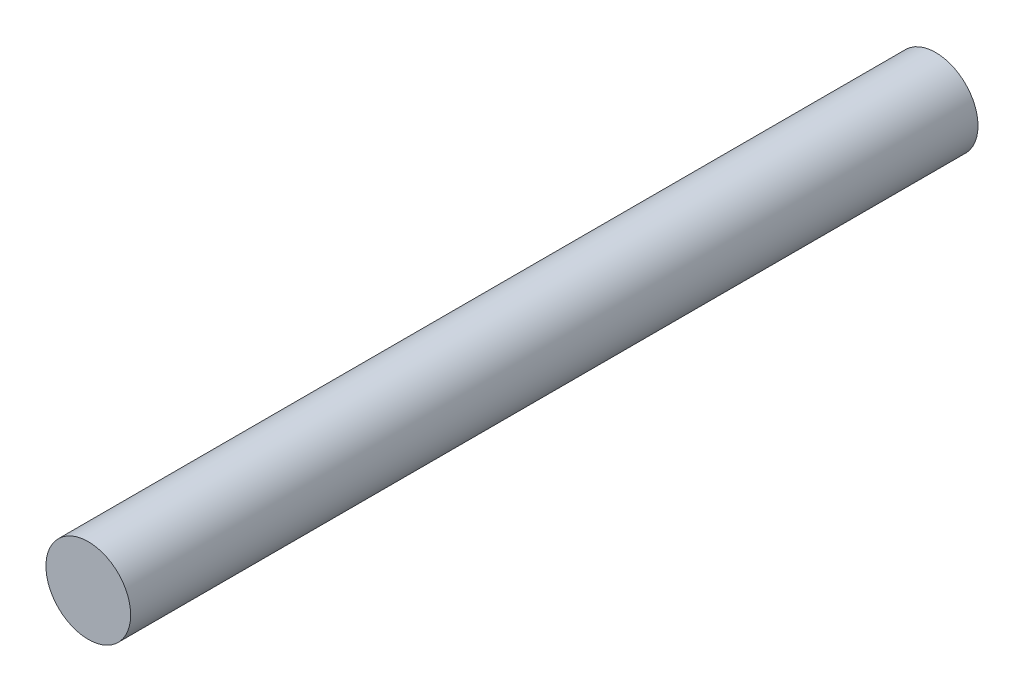
from build123d import *

# Parameters (mm, degrees)
ESQUISSE1_R        = 10
BOSS_EXTRU_1_DEPTH = 200


with BuildPart() as part:
    # Esquisse1 → Boss.-Extru.1 (new body)
    with BuildSketch(Plane.XY):
        Circle(ESQUISSE1_R)
    extrude(amount=BOSS_EXTRU_1_DEPTH)


solid = part.part
